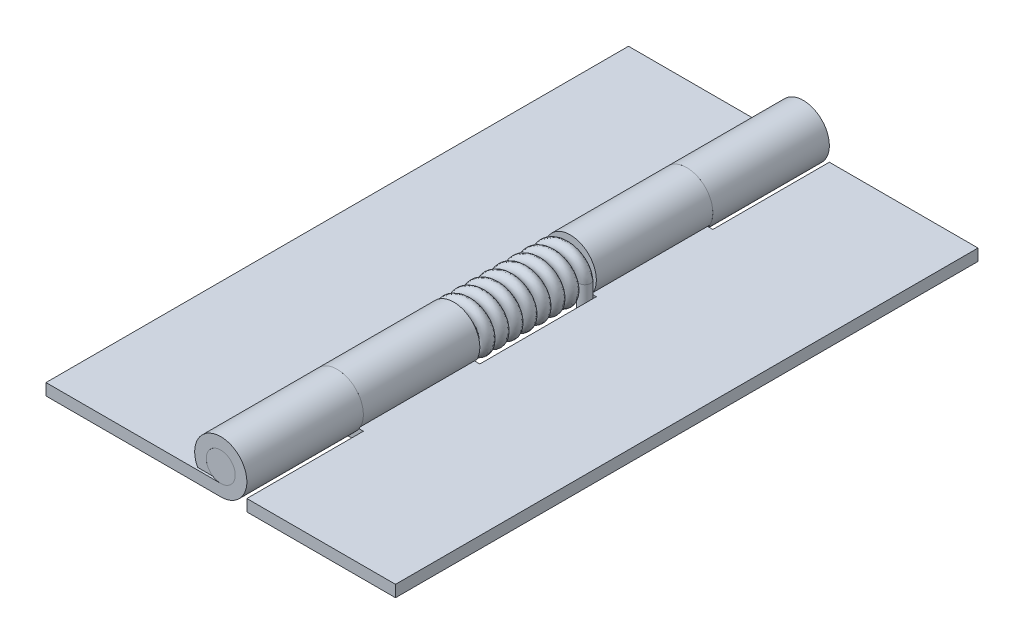
from build123d import *

# Parameters (mm, degrees)
EXTRUDE1_DEPTH     = 31.75
CUT_EXTRUDE1_DEPTH = 34.269821341
EXTRUDE2_DEPTH     = 31.75
SKETCH4_W          = 2.8448
SKETCH4_H          = 6.35
CUT_EXTRUDE2_DEPTH = 34.269821341
SKETCH5_R          = 0.7874
EXTRUDE3_DEPTH     = 31.75
SWEEP12_PITCH      = 0.762
SWEEP12_HEIGHT     = 5.715
SWEEP12_RADIUS     = 1.1049
SKETCH6_R          = 0.3175
SKETCH6_4_R        = 0.3175
SKETCH11_R         = 0.3175


with BuildPart() as part:
    # Sketch1 → Extrude1 (new body)
    with BuildSketch(Plane.XY):
        with BuildLine():
            Line((-9.525, 0), (0, 0))
            ThreePointArc((0, 0), (0.736161939, 2.639481493), (-1.259799032, 0.762))
            Line((-1.259799032, 0.762), (-0.428801353, 0.762))
            ThreePointArc((-0.428801353, 0.762), (0.223606574, 2.177382689), (0, 0.635))
            Line((0, 0.635), (-9.525, 0.635))
            Line((-9.525, 0.635), (-9.525, 0))
        make_face()
    extrude(amount=-EXTRUDE1_DEPTH)

    # Sketch2 → Cut-Extrude1 (cut, through all)
    with BuildSketch(Plane(origin=(0, 0, 0), x_dir=(1, 0, 0), z_dir=(0, 1, 0))):
        Polygon((1.4224, 6.35), (-1.4224, 6.35), (-1.4224, 12.7), (-1.4224, 19.05), (-1.4224, 25.4), (1.4224, 25.4), (1.4224, 19.05), (1.4224, 12.7), align=None)
    extrude(amount=CUT_EXTRUDE1_DEPTH, mode=Mode.SUBTRACT)


with BuildPart() as body_2:
    # Sketch3 → Extrude2 (new body)
    with BuildSketch(Plane.XY):
        with BuildLine():
            Line((0, 0), (9.525, 0))
            Line((9.525, 0), (9.525, 0.635))
            Line((9.525, 0.635), (0, 0.635))
            ThreePointArc((0, 0.635), (-0.223606574, 2.177382689), (0.428801353, 0.762))
            Line((0.428801353, 0.762), (1.259799032, 0.762))
            ThreePointArc((1.259799032, 0.762), (-0.736161939, 2.639481493), (0, 0))
        make_face()
    extrude(amount=-EXTRUDE2_DEPTH)

    # Sketch4 → Cut-Extrude2 (cut, through all)
    with BuildSketch(Plane(origin=(0, 0, 0), x_dir=(1, 0, 0), z_dir=(0, 1, 0))):
        with Locations((0, 15.875)):
            Rectangle(SKETCH4_W, SKETCH4_H)
        with Locations((0, 3.175)):
            Rectangle(SKETCH4_W, SKETCH4_H)
        with Locations((0, 28.575)):
            Rectangle(SKETCH4_W, SKETCH4_H)
    extrude(amount=CUT_EXTRUDE2_DEPTH, mode=Mode.SUBTRACT)


with BuildPart() as body_3:
    # Sketch5 → Extrude3 (new body)
    with BuildSketch(Plane.XY):
        with Locations((0, 1.4224)):
            Circle(SKETCH5_R)
    extrude(amount=-EXTRUDE3_DEPTH)


with BuildPart() as body_4:
    # Sweep12: sweep along a helix
    with BuildLine() as sweep12_path:
        Helix(SWEEP12_PITCH, SWEEP12_HEIGHT, SWEEP12_RADIUS, center=(0, 1.4224, -18.7325), direction=(0, 0, 1))
    # Sketch6 → Sweep12 (sweep)
    with BuildSketch(Plane(origin=(-38.1, 1.4224, -35.9283), x_dir=(1, 0, 0), z_dir=(0, 1, 0))):
        with Locations((39.2049, -17.1958)):
            Circle(SKETCH6_R)
    sweep(path=sweep12_path.line, is_frenet=True)


with BuildPart() as body_5:
    # Sweep5: sweep along a path in Sketch10
    with BuildLine(Plane.XY.offset(-18.7325)) as sweep5_path:
        Line((8.334375, -0.3175), (1.501775, -0.3175))
        ThreePointArc((1.501775, -0.3175), (1.221141996, -0.201258004), (1.1049, 0.079375))
        Line((1.1049, 0.079375), (1.1049, 1.4224))
    # Sketch6<4> → Sweep5 (sweep)
    with BuildSketch(Plane(origin=(-38.1, 1.4224, -35.9283), x_dir=(1, 0, 0), z_dir=(0, 1, 0))):
        with Locations((39.2049, -17.1958)):
            Circle(SKETCH6_4_R)
    sweep(path=sweep5_path.line)


with BuildPart() as body_6:
    # Sweep7: sweep along a path in Sketch12
    with BuildLine(Plane.XY.offset(-13.0175)) as sweep7_path:
        Line((-1.1049, 1.4224), (-1.1049, 0.079375))
        ThreePointArc((-1.1049, 0.079375), (-1.221141996, -0.201258004), (-1.501775, -0.3175))
        Line((-1.501775, -0.3175), (-8.334375, -0.3175))
    # Sketch11 → Sweep7 (sweep)
    with BuildSketch(Plane.XZ.offset(-1.4224)):
        with Locations((-1.1049, -13.0175)):
            Circle(SKETCH11_R)
    sweep(path=sweep7_path.line)


with BuildPart() as body_5_1:
    add(body_5.part)

    # Combine1: union body 6, body 4
    add(body_6.part)
    add(body_4.part)


solid = Compound([part.part, body_2.part, body_3.part, body_5_1.part])
